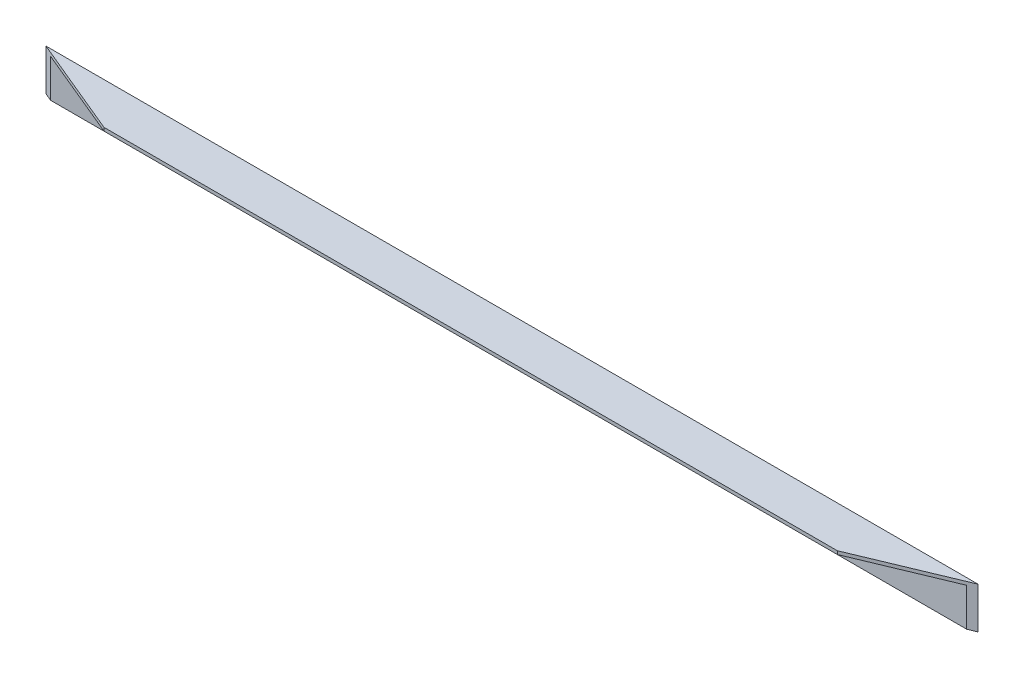
from build123d import *

# Parameters (mm, degrees)
SKETCH_1_W          = 2252
SKETCH_1_H          = 100
EXTRUDE_1_DEPTH     = 8
SKETCH_2_W          = 2252
SKETCH_2_H          = 8
EXTRUDE_2_DEPTH     = 92
CUT_EXTRUDE_3_DEPTH = 1135.846245092


with BuildPart() as part:
    # 草图1 → 凸台-拉伸1 (new body)
    with BuildSketch(Plane.XY):
        with Locations((0, 50)):
            Rectangle(SKETCH_1_W, SKETCH_1_H)
    extrude(amount=EXTRUDE_1_DEPTH)

    # 草图2 → 凸台-拉伸2 (add)
    with BuildSketch(Plane.XY.offset(8)):
        with Locations((0, 96)):
            Rectangle(SKETCH_2_W, SKETCH_2_H)
    extrude(amount=EXTRUDE_2_DEPTH)

    # 草图3 → 切除-拉伸3 (cut, through all)
    with BuildSketch(Plane(origin=(0, 100, 0), x_dir=(1, 0, 0), z_dir=(0, 1, 0))):
        Polygon((886, -100), (1126, 0), (1126, -100), align=None)
    cut_extrude_3 = extrude(amount=-CUT_EXTRUDE_3_DEPTH, mode=Mode.SUBTRACT)

    # 镜向8: 切除-拉伸3 across plane
    add(cut_extrude_3.mirror(Plane(origin=(0, 0, 0), x_dir=(0, 0, 1), z_dir=(1, 0, 0))), mode=Mode.SUBTRACT)


solid = part.part
